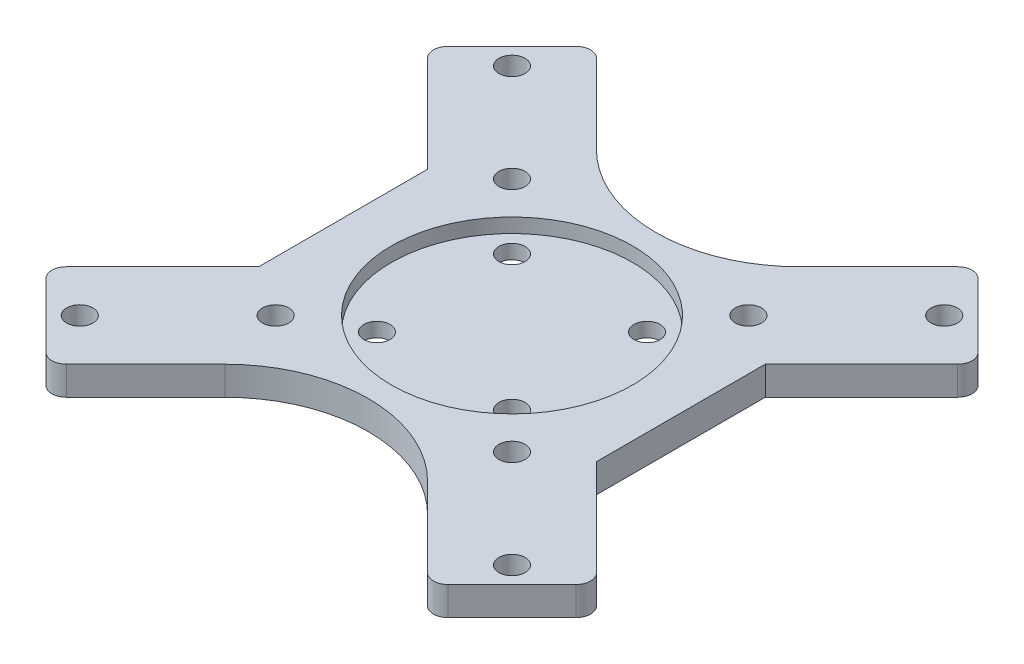
from build123d import *

# Parameters (mm, degrees)
SKETCH1_R           = 2.75
BOSS_EXTRUDE1_DEPTH = 6
FILLET1_R           = 3
SKETCH2_R           = 25.25
CUT_EXTRUDE1_DEPTH  = 3


with BuildPart() as part:
    # Sketch1 → Boss-Extrude1 (new body)
    with BuildSketch(Plane(origin=(0, 0, 0), x_dir=(1, 0, 0), z_dir=(0, 1, 0))):
        with BuildLine():
            Line((-57.629202667, 39.951533137), (-39.951533137, 57.629202667))
            Line((-39.951533137, 57.629202667), (-21.213203436, 38.890872965))
            ThreePointArc((-21.213203436, 38.890872965), (0, 30.104076401), (21.213203436, 38.890872965))
            Line((21.213203436, 38.890872965), (39.951533137, 57.629202667))
            Line((39.951533137, 57.629202667), (57.629202667, 39.951533137))
            Line((57.629202667, 39.951533137), (35.355339059, 17.67766953))
            Line((35.355339059, 17.67766953), (35.355339059, -17.67766953))
            Line((35.355339059, -17.67766953), (57.629202667, -39.951533137))
            Line((57.629202667, -39.951533137), (39.951533137, -57.629202667))
            Line((39.951533137, -57.629202667), (21.213203436, -38.890872965))
            ThreePointArc((21.213203436, -38.890872965), (0, -30.104076401), (-21.213203436, -38.890872965))
            Line((-21.213203436, -38.890872965), (-39.951533137, -57.629202667))
            Line((-39.951533137, -57.629202667), (-57.629202667, -39.951533137))
            Line((-57.629202667, -39.951533137), (-35.355339059, -17.67766953))
            Line((-35.355339059, -17.67766953), (-35.355339059, 17.67766953))
            Line((-35.355339059, 17.67766953), (-57.629202667, 39.951533137))
        make_face()
        with Locations(Location((-45.254833996, 45.254833996, 0), (0, 0, 270))):
            Circle(SKETCH1_R, mode=Mode.SUBTRACT)
        with Locations(Location((45.254833996, 45.254833996, 0), (0, 0, 270))):
            Circle(SKETCH1_R, mode=Mode.SUBTRACT)
        with Locations(Location((45.254833996, -45.254833996, 0), (0, 0, 270))):
            Circle(SKETCH1_R, mode=Mode.SUBTRACT)
        with Locations(Location((-45.254833996, -45.254833996, 0), (0, 0, 270))):
            Circle(SKETCH1_R, mode=Mode.SUBTRACT)
        with Locations(Location((-24.75, 24.75, 0), (0, 0, 270))):
            Circle(SKETCH1_R, mode=Mode.SUBTRACT)
        with Locations(Location((-24.75, -24.75, 0), (0, 0, 270))):
            Circle(SKETCH1_R, mode=Mode.SUBTRACT)
        with Locations(Location((24.75, -24.75, 0), (0, 0, 90))):
            Circle(SKETCH1_R, mode=Mode.SUBTRACT)
        with Locations(Location((24.75, 24.75, 0), (0, 0, 90))):
            Circle(SKETCH1_R, mode=Mode.SUBTRACT)
        with Locations(Location((-14.142135624, 14.142135624, 0), (0, 0, 270))):
            Circle(SKETCH1_R, mode=Mode.SUBTRACT)
        with Locations(Location((14.142135624, 14.142135624, 0), (0, 0, 270))):
            Circle(SKETCH1_R, mode=Mode.SUBTRACT)
        with Locations(Location((14.142135624, -14.142135624, 0), (0, 0, 270))):
            Circle(SKETCH1_R, mode=Mode.SUBTRACT)
        with Locations(Location((-14.142135624, -14.142135624, 0), (0, 0, 270))):
            Circle(SKETCH1_R, mode=Mode.SUBTRACT)
    extrude(amount=BOSS_EXTRUDE1_DEPTH)

    # Fillet1
    fillet1_edges = [part.edges().sort_by_distance(p)[0] for p in [
        (-57.629202667, 3, -39.951533137),
        (-39.951533137, 3, -57.629202667),
        (39.951533137, 3, -57.629202667),
        (57.629202667, 3, -39.951533137),
        (57.629202667, 3, 39.951533137),
        (39.951533137, 3, 57.629202667),
        (-39.951533137, 3, 57.629202667),
        (-57.629202667, 3, 39.951533137),
    ]]
    fillet(fillet1_edges, radius=FILLET1_R)

    # Sketch2 → Cut-Extrude1 (cut)
    with BuildSketch(Plane(origin=(0, 6, 0), x_dir=(1, 0, 0), z_dir=(0, 1, 0))):
        with Locations(Location((0, 0, 0), (0, 0, 270))):
            Circle(SKETCH2_R)
    extrude(amount=-CUT_EXTRUDE1_DEPTH, mode=Mode.SUBTRACT)


solid = part.part
